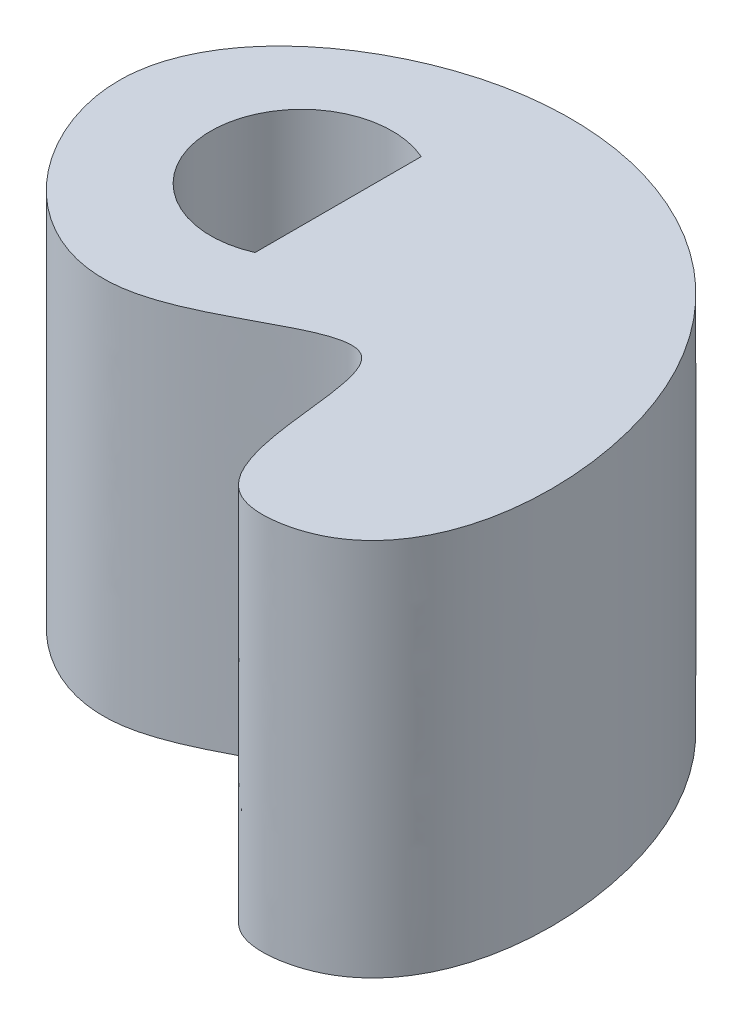
from build123d import *

# Parameters (mm, degrees)
BOSS_EXTRUDE1_DEPTH = 6.3


with BuildPart() as part:
    # Sketch1 → Boss-Extrude1 (new body)
    with BuildSketch(Plane(origin=(0, 0, 0), x_dir=(1, 0, 0), z_dir=(0, 1, 0))):
        with BuildLine():
            add(Edge.make_bspline(
                [(-3, 0), (-2.976773332, 1.453440684), (0.783824637, 4.397122695), (6.909325202, 1.540885965), (6.677772715, -4.953955768), (3.026382216, -5.234625788), (3.830864242, -0.30138575), (-0.561402622, -4.536477223), (-3.023226668, -1.453440684), (-3, 0)],
                knots=[0, 0, 0, 0, 0.153623907, 0.396524632, 0.581157591, 0.617367093, 0.731871593, 0.846376093, 1, 1, 1, 1], degree=3))
        make_face()
        with BuildLine():
            Line((0.6091886, 1.381661771), (0.6091886, -1.381661771))
            ThreePointArc((0.6091886, -1.381661771), (-1.51, 0), (0.6091886, 1.381661771))
        make_face(mode=Mode.SUBTRACT)
    extrude(amount=BOSS_EXTRUDE1_DEPTH)


solid = part.part
